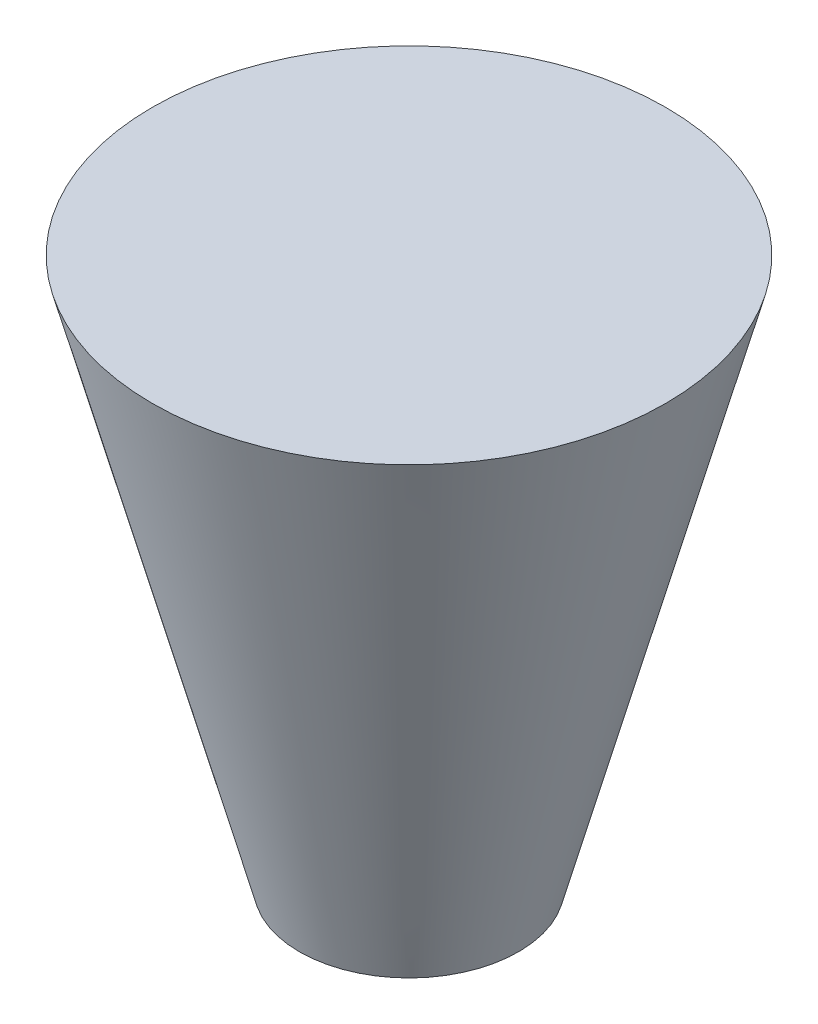
from build123d import *

# Parameters (mm, degrees)
SKETCH1_R           = 10
BOSS_EXTRUDE1_DEPTH = 50
BOSS_EXTRUDE1_DRAFT = -15


with BuildPart() as part:
    # Sketch1 → Boss-Extrude1 (with draft: the straight prism first)
    with BuildSketch(Plane(origin=(0, 0, 0), x_dir=(1, 0, 0), z_dir=(0, 1, 0))):
        Circle(SKETCH1_R)
    extrude(amount=BOSS_EXTRUDE1_DEPTH)
    # Boss-Extrude1: the draft: its side faces are tilted about the plane it starts from
    boss_extrude1_sides = [part.faces().sort_by_distance(p)[0] for p in [
        (-10, 25, 0),
    ]]
    draft(boss_extrude1_sides, Plane(origin=(0, 0, 0), x_dir=(1, 0, 0), z_dir=(0, 1, 0)), BOSS_EXTRUDE1_DRAFT)


solid = part.part
